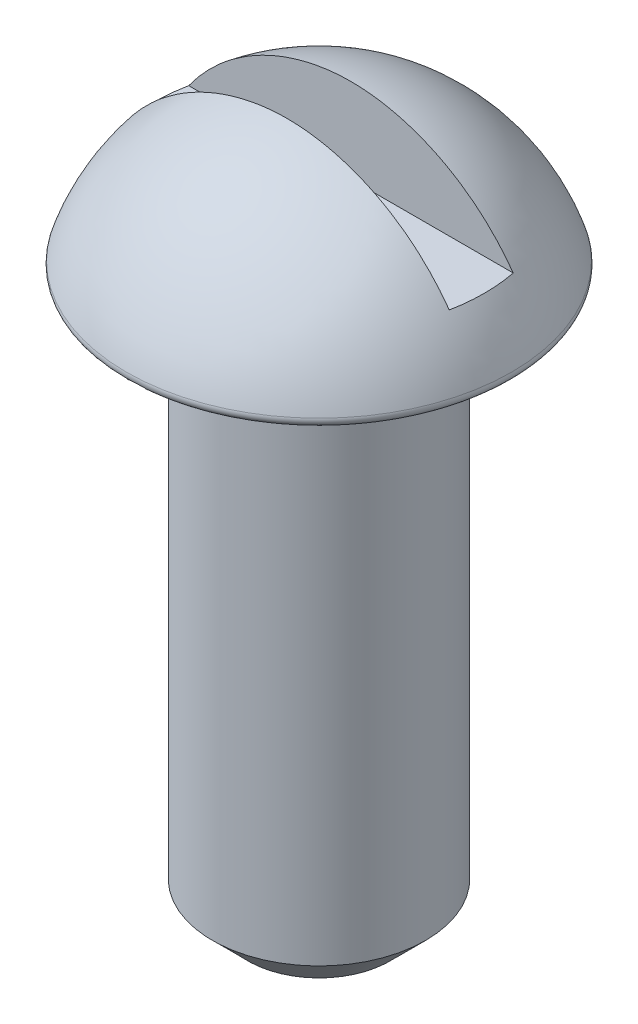
from build123d import *

# Parameters (mm, degrees)
SKETCH_13_W         = 5.5
SKETCH_13_H         = 0.9
CUT_EXTRUDE_9_DEPTH = 1.2
FILLET_1_R          = 0.1
CHAMFER_1_SIZE      = 0.5


with BuildPart() as part:
    # Эскиз1 → Повернуть1 (revolve)
    with BuildSketch(Plane.XY):
        with BuildLine():
            Line((1.5, 90.535646063), (2.75, 90.535646063))
            ThreePointArc((2.75, 90.535646063), (1.885165475, 91.932735999), (0.4, 92.635646063))
            Line((0.4, 92.635646063), (0, 92.635646063))
            Line((0, 92.635646063), (0, 82.635646063))
            Line((0, 82.635646063), (1.5, 82.635646063))
            Line((1.5, 82.635646063), (1.5, 90.535646063))
        make_face()
    revolve(axis=Axis((0, 125.763182898, 0), (0, -1, 0)))

    # Эскиз13 → Вырез-Вытянуть9 (cut)
    with BuildSketch(Plane(origin=(0, 92.635646063, 0), x_dir=(-1, 0, 0), z_dir=(0, 1, 0))):
        Rectangle(SKETCH_13_W, SKETCH_13_H)
    extrude(amount=-CUT_EXTRUDE_9_DEPTH, mode=Mode.SUBTRACT)

    # Скругление1
    fillet_1_edges = [part.edges().sort_by_distance(p)[0] for p in [
        (-2.75, 90.535646063, 0),
    ]]
    fillet(fillet_1_edges, radius=FILLET_1_R)

    # Фаска1
    chamfer_1_edges = [part.edges().sort_by_distance(p)[0] for p in [
        (-1.5, 82.635646063, 0),
    ]]
    chamfer(chamfer_1_edges, length=CHAMFER_1_SIZE)


solid = part.part
